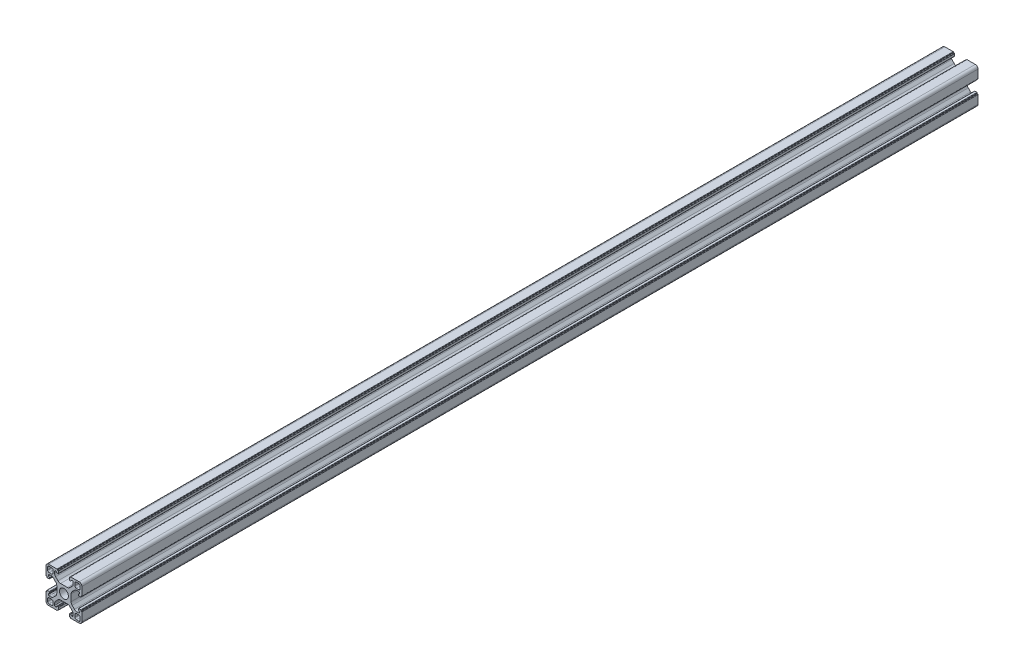
from build123d import *

# Parameters (mm, degrees)
EXTRUDE_1_DEPTH = 500


with BuildPart() as part:
    # Эскиз1 → Бобышка-Вытянуть1 (new body)
    with BuildSketch(Plane.XY):
        with BuildLine():
            Line((-31.105150957, 65.209647948), (-29.206370287, 65.209647948))
            ThreePointArc((-29.206370287, 65.209647948), (-28.441003423, 65.361888883), (-27.792156725, 65.795434385))
            Line((-27.792156725, 65.795434385), (-26.490937394, 67.096653716))
            ThreePointArc((-26.490937394, 67.096653716), (-26.057391892, 67.745500414), (-25.905150957, 68.510867279))
            Line((-25.905150957, 68.510867279), (-25.905150957, 69.409647948))
            ThreePointArc((-25.905150957, 69.409647948), (-26.051597566, 69.763201338), (-26.405150957, 69.909647948))
            Line((-26.405150957, 69.909647948), (-26.508044175, 69.909647948))
            ThreePointArc((-26.508044175, 69.909647948), (-26.699385892, 69.871587714), (-26.861597566, 69.763201338))
            Line((-26.861597566, 69.763201338), (-27.341927652, 69.282871252))
            ThreePointArc((-27.341927652, 69.282871252), (-27.423033489, 69.228678065), (-27.518704347, 69.209647948))
            Line((-27.518704347, 69.209647948), (-27.805150957, 69.209647948))
            ThreePointArc((-27.805150957, 69.209647948), (-27.981927652, 69.282871252), (-28.055150957, 69.459647948))
            Line((-28.055150957, 69.459647948), (-28.055150957, 70.608718768))
            ThreePointArc((-28.055150957, 70.608718768), (-28.011216974, 70.714784785), (-27.905150957, 70.758718768))
            Line((-27.905150957, 70.758718768), (-27.405150957, 70.758718768))
            Line((-27.405150957, 70.758718768), (-27.405150957, 71.059647948))
            ThreePointArc((-27.405150957, 71.059647948), (-27.361216974, 71.165713965), (-27.255150957, 71.209647948))
            Line((-27.255150957, 71.209647948), (-22.605150957, 71.209647948))
            ThreePointArc((-22.605150957, 71.209647948), (-21.544490785, 70.770308119), (-21.105150957, 69.709647948))
            Line((-21.105150957, 69.709647948), (-21.105150957, 65.059647948))
            ThreePointArc((-21.105150957, 65.059647948), (-21.149084939, 64.953581931), (-21.255150957, 64.909647948))
            Line((-21.255150957, 64.909647948), (-21.556080136, 64.909647948))
            Line((-21.556080136, 64.909647948), (-21.556080136, 64.409647948))
            ThreePointArc((-21.556080136, 64.409647948), (-21.600014119, 64.303581931), (-21.706080136, 64.259647948))
            Line((-21.706080136, 64.259647948), (-22.855150957, 64.259647948))
            ThreePointArc((-22.855150957, 64.259647948), (-23.031927652, 64.332871252), (-23.105150957, 64.509647948))
            Line((-23.105150957, 64.509647948), (-23.105150957, 64.796094557))
            ThreePointArc((-23.105150957, 64.796094557), (-23.08612084, 64.891765415), (-23.031927652, 64.972871252))
            Line((-23.031927652, 64.972871252), (-22.551597566, 65.453201338))
            ThreePointArc((-22.551597566, 65.453201338), (-22.44321119, 65.615413013), (-22.405150957, 65.806754729))
            Line((-22.405150957, 65.806754729), (-22.405150957, 65.909647948))
            ThreePointArc((-22.405150957, 65.909647948), (-22.551597566, 66.263201338), (-22.905150957, 66.409647948))
            Line((-22.905150957, 66.409647948), (-23.803931626, 66.409647948))
            ThreePointArc((-23.803931626, 66.409647948), (-24.56929849, 66.257407013), (-25.218145188, 65.82386151))
            Line((-25.218145188, 65.82386151), (-26.519364519, 64.522642179))
            ThreePointArc((-26.519364519, 64.522642179), (-26.952910022, 63.873795482), (-27.105150957, 63.108428617))
            Line((-27.105150957, 63.108428617), (-27.105150957, 61.209647948))
            Line((-27.105150957, 61.209647948), (-27.105150957, 59.310867279))
            ThreePointArc((-27.105150957, 59.310867279), (-26.952910022, 58.545500414), (-26.519364519, 57.896653716))
            Line((-26.519364519, 57.896653716), (-25.218145188, 56.595434385))
            ThreePointArc((-25.218145188, 56.595434385), (-24.56929849, 56.161888883), (-23.803931626, 56.009647948))
            Line((-23.803931626, 56.009647948), (-22.905150957, 56.009647948))
            ThreePointArc((-22.905150957, 56.009647948), (-22.551597566, 56.156094557), (-22.405150957, 56.509647948))
            Line((-22.405150957, 56.509647948), (-22.405150957, 56.612541166))
            ThreePointArc((-22.405150957, 56.612541166), (-22.44321119, 56.803882883), (-22.551597566, 56.966094557))
            Line((-22.551597566, 56.966094557), (-23.031927652, 57.446424643))
            ThreePointArc((-23.031927652, 57.446424643), (-23.08612084, 57.52753048), (-23.105150957, 57.623201338))
            Line((-23.105150957, 57.623201338), (-23.105150957, 57.909647948))
            ThreePointArc((-23.105150957, 57.909647948), (-23.031927652, 58.086424643), (-22.855150957, 58.159647948))
            Line((-22.855150957, 58.159647948), (-21.706080136, 58.159647948))
            ThreePointArc((-21.706080136, 58.159647948), (-21.600014119, 58.115713965), (-21.556080136, 58.009647948))
            Line((-21.556080136, 58.009647948), (-21.556080136, 57.509647948))
            Line((-21.556080136, 57.509647948), (-21.255150957, 57.509647948))
            ThreePointArc((-21.255150957, 57.509647948), (-21.149084939, 57.465713965), (-21.105150957, 57.359647948))
            Line((-21.105150957, 57.359647948), (-21.105150957, 52.709647948))
            ThreePointArc((-21.105150957, 52.709647948), (-21.544490785, 51.648987776), (-22.605150957, 51.209647948))
            Line((-22.605150957, 51.209647948), (-27.255150957, 51.209647948))
            ThreePointArc((-27.255150957, 51.209647948), (-27.361216974, 51.253581931), (-27.405150957, 51.359647948))
            Line((-27.405150957, 51.359647948), (-27.405150957, 51.660577127))
            Line((-27.405150957, 51.660577127), (-27.905150957, 51.660577127))
            ThreePointArc((-27.905150957, 51.660577127), (-28.011216974, 51.70451111), (-28.055150957, 51.810577127))
            Line((-28.055150957, 51.810577127), (-28.055150957, 52.959647948))
            ThreePointArc((-28.055150957, 52.959647948), (-27.981927652, 53.136424643), (-27.805150957, 53.209647948))
            Line((-27.805150957, 53.209647948), (-27.518704347, 53.209647948))
            ThreePointArc((-27.518704347, 53.209647948), (-27.423033489, 53.190617831), (-27.341927652, 53.136424643))
            Line((-27.341927652, 53.136424643), (-26.861597566, 52.656094557))
            ThreePointArc((-26.861597566, 52.656094557), (-26.699385892, 52.547708181), (-26.508044175, 52.509647948))
            Line((-26.508044175, 52.509647948), (-26.405150957, 52.509647948))
            ThreePointArc((-26.405150957, 52.509647948), (-26.051597566, 52.656094557), (-25.905150957, 53.009647948))
            Line((-25.905150957, 53.009647948), (-25.905150957, 53.908428617))
            ThreePointArc((-25.905150957, 53.908428617), (-26.057391892, 54.673795482), (-26.490937394, 55.322642179))
            Line((-26.490937394, 55.322642179), (-27.792156725, 56.62386151))
            ThreePointArc((-27.792156725, 56.62386151), (-28.441003423, 57.057407013), (-29.206370287, 57.209647948))
            Line((-29.206370287, 57.209647948), (-31.105150957, 57.209647948))
            Line((-31.105150957, 57.209647948), (-33.003931626, 57.209647948))
            ThreePointArc((-33.003931626, 57.209647948), (-33.76929849, 57.057407013), (-34.418145188, 56.62386151))
            Line((-34.418145188, 56.62386151), (-35.719364519, 55.322642179))
            ThreePointArc((-35.719364519, 55.322642179), (-36.152910022, 54.673795482), (-36.305150957, 53.908428617))
            Line((-36.305150957, 53.908428617), (-36.305150957, 53.009647948))
            ThreePointArc((-36.305150957, 53.009647948), (-36.158704347, 52.656094557), (-35.805150957, 52.509647948))
            Line((-35.805150957, 52.509647948), (-35.702257738, 52.509647948))
            ThreePointArc((-35.702257738, 52.509647948), (-35.510916022, 52.547708181), (-35.348704347, 52.656094557))
            Line((-35.348704347, 52.656094557), (-34.868374261, 53.136424643))
            ThreePointArc((-34.868374261, 53.136424643), (-34.787268424, 53.190617831), (-34.691597566, 53.209647948))
            Line((-34.691597566, 53.209647948), (-34.405150957, 53.209647948))
            ThreePointArc((-34.405150957, 53.209647948), (-34.228374261, 53.136424643), (-34.155150957, 52.959647948))
            Line((-34.155150957, 52.959647948), (-34.155150957, 51.810577127))
            ThreePointArc((-34.155150957, 51.810577127), (-34.199084939, 51.70451111), (-34.305150957, 51.660577127))
            Line((-34.305150957, 51.660577127), (-34.805150957, 51.660577127))
            Line((-34.805150957, 51.660577127), (-34.805150957, 51.359647948))
            ThreePointArc((-34.805150957, 51.359647948), (-34.849084939, 51.253581931), (-34.955150957, 51.209647948))
            Line((-34.955150957, 51.209647948), (-39.605150957, 51.209647948))
            ThreePointArc((-39.605150957, 51.209647948), (-40.665811128, 51.648987776), (-41.105150957, 52.709647948))
            Line((-41.105150957, 52.709647948), (-41.105150957, 57.359647948))
            ThreePointArc((-41.105150957, 57.359647948), (-41.061216974, 57.465713965), (-40.955150957, 57.509647948))
            Line((-40.955150957, 57.509647948), (-40.654221777, 57.509647948))
            Line((-40.654221777, 57.509647948), (-40.654221777, 58.009647948))
            ThreePointArc((-40.654221777, 58.009647948), (-40.610287794, 58.115713965), (-40.504221777, 58.159647948))
            Line((-40.504221777, 58.159647948), (-39.355150957, 58.159647948))
            ThreePointArc((-39.355150957, 58.159647948), (-39.178374261, 58.086424643), (-39.105150957, 57.909647948))
            Line((-39.105150957, 57.909647948), (-39.105150957, 57.623201338))
            ThreePointArc((-39.105150957, 57.623201338), (-39.124181073, 57.52753048), (-39.178374261, 57.446424643))
            Line((-39.178374261, 57.446424643), (-39.658704347, 56.966094557))
            ThreePointArc((-39.658704347, 56.966094557), (-39.767090723, 56.803882883), (-39.805150957, 56.612541166))
            Line((-39.805150957, 56.612541166), (-39.805150957, 56.509647948))
            ThreePointArc((-39.805150957, 56.509647948), (-39.658704347, 56.156094557), (-39.305150957, 56.009647948))
            Line((-39.305150957, 56.009647948), (-38.406370287, 56.009647948))
            ThreePointArc((-38.406370287, 56.009647948), (-37.641003423, 56.161888883), (-36.992156725, 56.595434385))
            Line((-36.992156725, 56.595434385), (-35.690937394, 57.896653716))
            ThreePointArc((-35.690937394, 57.896653716), (-35.257391892, 58.545500414), (-35.105150957, 59.310867279))
            Line((-35.105150957, 59.310867279), (-35.105150957, 61.209647948))
            Line((-35.105150957, 61.209647948), (-35.105150957, 63.108428617))
            ThreePointArc((-35.105150957, 63.108428617), (-35.257391892, 63.873795482), (-35.690937394, 64.522642179))
            Line((-35.690937394, 64.522642179), (-36.992156725, 65.82386151))
            ThreePointArc((-36.992156725, 65.82386151), (-37.641003423, 66.257407013), (-38.406370287, 66.409647948))
            Line((-38.406370287, 66.409647948), (-39.305150957, 66.409647948))
            ThreePointArc((-39.305150957, 66.409647948), (-39.658704347, 66.263201338), (-39.805150957, 65.909647948))
            Line((-39.805150957, 65.909647948), (-39.805150957, 65.806754729))
            ThreePointArc((-39.805150957, 65.806754729), (-39.767090723, 65.615413013), (-39.658704347, 65.453201338))
            Line((-39.658704347, 65.453201338), (-39.178374261, 64.972871252))
            ThreePointArc((-39.178374261, 64.972871252), (-39.124181073, 64.891765415), (-39.105150957, 64.796094557))
            Line((-39.105150957, 64.796094557), (-39.105150957, 64.509647948))
            ThreePointArc((-39.105150957, 64.509647948), (-39.178374261, 64.332871252), (-39.355150957, 64.259647948))
            Line((-39.355150957, 64.259647948), (-40.504221777, 64.259647948))
            ThreePointArc((-40.504221777, 64.259647948), (-40.610287794, 64.303581931), (-40.654221777, 64.409647948))
            Line((-40.654221777, 64.409647948), (-40.654221777, 64.909647948))
            Line((-40.654221777, 64.909647948), (-40.955150957, 64.909647948))
            ThreePointArc((-40.955150957, 64.909647948), (-41.061216974, 64.953581931), (-41.105150957, 65.059647948))
            Line((-41.105150957, 65.059647948), (-41.105150957, 69.709647948))
            ThreePointArc((-41.105150957, 69.709647948), (-40.665811128, 70.770308119), (-39.605150957, 71.209647948))
            Line((-39.605150957, 71.209647948), (-34.955150957, 71.209647948))
            ThreePointArc((-34.955150957, 71.209647948), (-34.849084939, 71.165713965), (-34.805150957, 71.059647948))
            Line((-34.805150957, 71.059647948), (-34.805150957, 70.758718768))
            Line((-34.805150957, 70.758718768), (-34.305150957, 70.758718768))
            ThreePointArc((-34.305150957, 70.758718768), (-34.199084939, 70.714784785), (-34.155150957, 70.608718768))
            Line((-34.155150957, 70.608718768), (-34.155150957, 69.459647948))
            ThreePointArc((-34.155150957, 69.459647948), (-34.228374261, 69.282871252), (-34.405150957, 69.209647948))
            Line((-34.405150957, 69.209647948), (-34.691597566, 69.209647948))
            ThreePointArc((-34.691597566, 69.209647948), (-34.787268424, 69.228678065), (-34.868374261, 69.282871252))
            Line((-34.868374261, 69.282871252), (-35.348704347, 69.763201338))
            ThreePointArc((-35.348704347, 69.763201338), (-35.510916022, 69.871587714), (-35.702257738, 69.909647948))
            Line((-35.702257738, 69.909647948), (-35.805150957, 69.909647948))
            ThreePointArc((-35.805150957, 69.909647948), (-36.158704347, 69.763201338), (-36.305150957, 69.409647948))
            Line((-36.305150957, 69.409647948), (-36.305150957, 68.510867279))
            ThreePointArc((-36.305150957, 68.510867279), (-36.152910022, 67.745500414), (-35.719364519, 67.096653716))
            Line((-35.719364519, 67.096653716), (-34.418145188, 65.795434385))
            ThreePointArc((-34.418145188, 65.795434385), (-33.76929849, 65.361888883), (-33.003931626, 65.209647948))
            Line((-33.003931626, 65.209647948), (-31.105150957, 65.209647948))
        make_face()
        with BuildLine():
            Line((-24.205150957, 67.309647948), (-22.805150957, 67.309647948))
            ThreePointArc((-22.805150957, 67.309647948), (-22.239465532, 67.543962523), (-22.005150957, 68.109647948))
            Line((-22.005150957, 68.109647948), (-22.005150957, 69.509647948))
            ThreePointArc((-22.005150957, 69.509647948), (-22.239465532, 70.075333373), (-22.805150957, 70.309647948))
            Line((-22.805150957, 70.309647948), (-24.205150957, 70.309647948))
            ThreePointArc((-24.205150957, 70.309647948), (-24.770836381, 70.075333373), (-25.005150957, 69.509647948))
            Line((-25.005150957, 69.509647948), (-25.005150957, 68.109647948))
            ThreePointArc((-25.005150957, 68.109647948), (-24.770836381, 67.543962523), (-24.205150957, 67.309647948))
        make_face(mode=Mode.SUBTRACT)
        with BuildLine():
            Line((-25.005150957, 54.309647948), (-25.005150957, 52.909647948))
            ThreePointArc((-25.005150957, 52.909647948), (-24.770836381, 52.343962523), (-24.205150957, 52.109647948))
            Line((-24.205150957, 52.109647948), (-22.805150957, 52.109647948))
            ThreePointArc((-22.805150957, 52.109647948), (-22.239465532, 52.343962523), (-22.005150957, 52.909647948))
            Line((-22.005150957, 52.909647948), (-22.005150957, 54.309647948))
            ThreePointArc((-22.005150957, 54.309647948), (-22.239465532, 54.875333373), (-22.805150957, 55.109647948))
            Line((-22.805150957, 55.109647948), (-24.205150957, 55.109647948))
            ThreePointArc((-24.205150957, 55.109647948), (-24.770836381, 54.875333373), (-25.005150957, 54.309647948))
        make_face(mode=Mode.SUBTRACT)
        with BuildLine():
            Line((-38.005150957, 55.109647948), (-39.405150957, 55.109647948))
            ThreePointArc((-39.405150957, 55.109647948), (-39.970836381, 54.875333373), (-40.205150957, 54.309647948))
            Line((-40.205150957, 54.309647948), (-40.205150957, 52.909647948))
            ThreePointArc((-40.205150957, 52.909647948), (-39.970836381, 52.343962523), (-39.405150957, 52.109647948))
            Line((-39.405150957, 52.109647948), (-38.005150957, 52.109647948))
            ThreePointArc((-38.005150957, 52.109647948), (-37.439465532, 52.343962523), (-37.205150957, 52.909647948))
            Line((-37.205150957, 52.909647948), (-37.205150957, 54.309647948))
            ThreePointArc((-37.205150957, 54.309647948), (-37.439465532, 54.875333373), (-38.005150957, 55.109647948))
        make_face(mode=Mode.SUBTRACT)
        with BuildLine():
            Line((-37.205150957, 68.109647948), (-37.205150957, 69.509647948))
            ThreePointArc((-37.205150957, 69.509647948), (-37.439465532, 70.075333373), (-38.005150957, 70.309647948))
            Line((-38.005150957, 70.309647948), (-39.405150957, 70.309647948))
            ThreePointArc((-39.405150957, 70.309647948), (-39.970836381, 70.075333373), (-40.205150957, 69.509647948))
            Line((-40.205150957, 69.509647948), (-40.205150957, 68.109647948))
            ThreePointArc((-40.205150957, 68.109647948), (-39.970836381, 67.543962523), (-39.405150957, 67.309647948))
            Line((-39.405150957, 67.309647948), (-38.005150957, 67.309647948))
            ThreePointArc((-38.005150957, 67.309647948), (-37.439465532, 67.543962523), (-37.205150957, 68.109647948))
        make_face(mode=Mode.SUBTRACT)
        with BuildLine():
            ThreePointArc((-28.605150957, 61.209647948), (-29.337384004, 62.977414901), (-31.105150957, 63.709647948))
            ThreePointArc((-31.105150957, 63.709647948), (-32.87291791, 62.977414901), (-33.605150957, 61.209647948))
            ThreePointArc((-33.605150957, 61.209647948), (-32.87291791, 59.441880995), (-31.105150957, 58.709647948))
            ThreePointArc((-31.105150957, 58.709647948), (-29.337384004, 59.441880995), (-28.605150957, 61.209647948))
        make_face(mode=Mode.SUBTRACT)
    extrude(amount=EXTRUDE_1_DEPTH)


solid = part.part
